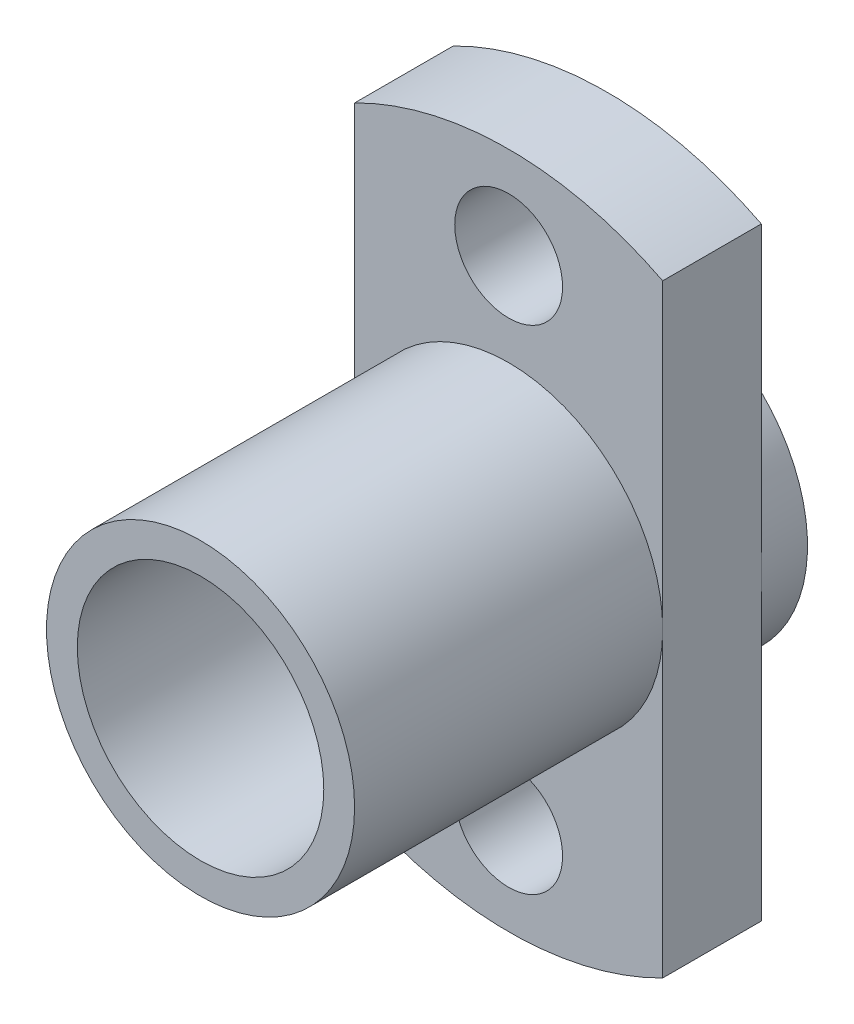
from build123d import *

# Parameters (mm, degrees)
SKETCH_1_R          = 11
EXTRUDE_1_DEPTH     = 3.2
SKETCH_2_R          = 5
EXTRUDE_2_DEPTH     = 10
SKETCH_3_R          = 4
CUT_EXTRUDE_1_DEPTH = 15
SKETCH_4_R          = 1.75
CUT_EXTRUDE_2_DEPTH = 7
CUT_EXTRUDE_4_DEPTH = 19.493242009
SKETCH_7_R          = 5
SKETCH_7_R_2        = 4
EXTRUDE_3_DEPTH     = 1.5


with BuildPart() as part:
    # 草图1 → 凸台-拉伸1 (new body)
    with BuildSketch(Plane.XY):
        Circle(SKETCH_1_R)
    extrude(amount=EXTRUDE_1_DEPTH)

    # 草图2 → 凸台-拉伸2 (add)
    with BuildSketch(Plane.XY.offset(3.2)):
        Circle(SKETCH_2_R)
    extrude(amount=EXTRUDE_2_DEPTH)

    # 草图3 → 切除-拉伸1 (cut)
    with BuildSketch(Plane.XY.offset(13.2)):
        Circle(SKETCH_3_R)
    extrude(amount=-CUT_EXTRUDE_1_DEPTH, mode=Mode.SUBTRACT)

    # 草图4 → 切除-拉伸2 (cut)
    with BuildSketch(Plane(origin=(0, 0, 0), x_dir=(-1, 0, 0), z_dir=(0, 0, -1))):
        with Locations((0, 8)):
            Circle(SKETCH_4_R)
        with Locations((0, -8)):
            Circle(SKETCH_4_R)
    extrude(amount=-CUT_EXTRUDE_2_DEPTH, mode=Mode.SUBTRACT)

    # 草图6 → 切除-拉伸4 (cut, through all)
    with BuildSketch(Plane.XY.offset(3.2)):
        Polygon((-5, 0), (-5, 10.334769888), (-11, 10.334769888), (-11, -9.812151942), (-5, -9.812151942), align=None)
        Polygon((11, -9.812151942), (5, -9.812151942), (5, 0), (5, 10.334769888), (11, 10.334769888), align=None)
    extrude(amount=-CUT_EXTRUDE_4_DEPTH, mode=Mode.SUBTRACT)

    # 草图7 → 凸台-拉伸3 (add)
    with BuildSketch(Plane(origin=(0, 0, 0), x_dir=(-1, 0, 0), z_dir=(0, 0, -1))):
        with Locations(Location((0, 0, 0), (0, 0, 180))):
            Circle(SKETCH_7_R)
        with Locations(Location((0, 0, 0), (0, 0, 180))):
            Circle(SKETCH_7_R_2, mode=Mode.SUBTRACT)
    extrude(amount=EXTRUDE_3_DEPTH)


solid = part.part
